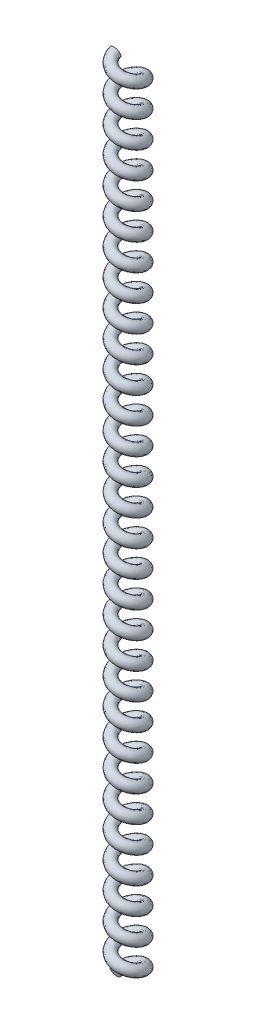
from build123d import *

# Parameters (mm, degrees)
SKETCH3_R = 1


with BuildPart() as part:
    # Sweep1: sweep along a curve in space
    with BuildLine() as sweep1_path:
        add(Edge.make_bspline(
            [(-2.5, 0, 0), (-2.5, 0.103560269, -0.325344182), (-2.369829679, 0.31278143, -0.982479294), (-1.813789111, 0.624924591, -1.813557683), (-0.981615594, 0.937520206, -2.36989169), (0, 1.249994586, -2.565068545), (0.981615594, 1.562501451, -2.369834131), (1.813789111, 1.874999611, -1.813787918), (2.369829679, 2.187500104, -0.981615913), (2.565085161, 2.499999972, 8.6e-08), (2.369829679, 2.812500007, 0.981615571), (1.813789111, 3.124999998, 1.813789117), (0.981615594, 3.437500001, 2.369829677), (0, 3.75, 2.565085161), (-0.981615594, 4.0625, 2.369829679), (-1.813789111, 4.375, 1.813789111), (-2.369829679, 4.6875, 0.981615594), (-2.565085161, 5, 0), (-2.369829679, 5.3125, -0.981615594), (-1.813789111, 5.625, -1.813789111), (-0.981615594, 5.9375, -2.369829679), (0, 6.25, -2.565085161), (0.981615594, 6.5625, -2.369829679), (1.813789111, 6.875, -1.813789111), (2.369829679, 7.1875, -0.981615594), (2.565085161, 7.5, 0), (2.369829679, 7.8125, 0.981615594), (1.813789111, 8.125, 1.813789111), (0.981615594, 8.4375, 2.369829679), (0, 8.75, 2.565085161), (-0.981615594, 9.0625, 2.369829679), (-1.813789111, 9.375, 1.813789111), (-2.369829679, 9.6875, 0.981615594), (-2.565085161, 10, 0), (-2.369829679, 10.3125, -0.981615594), (-1.813789111, 10.625, -1.813789111), (-0.981615594, 10.9375, -2.369829679), (0, 11.25, -2.565085161), (0.981615594, 11.5625, -2.369829679), (1.813789111, 11.875, -1.813789111), (2.369829679, 12.1875, -0.981615594), (2.565085161, 12.5, 0), (2.369829679, 12.8125, 0.981615594), (1.813789111, 13.125, 1.813789111), (0.981615594, 13.4375, 2.369829679), (0, 13.75, 2.565085161), (-0.981615594, 14.0625, 2.369829679), (-1.813789111, 14.375, 1.813789111), (-2.369829679, 14.6875, 0.981615594), (-2.565085161, 15, 0), (-2.369829679, 15.3125, -0.981615594), (-1.813789111, 15.625, -1.813789111), (-0.981615594, 15.9375, -2.369829679), (0, 16.25, -2.565085161), (0.981615594, 16.5625, -2.369829679), (1.813789111, 16.875, -1.813789111), (2.369829679, 17.1875, -0.981615594), (2.565085161, 17.5, 0), (2.369829679, 17.8125, 0.981615594), (1.813789111, 18.125, 1.813789111), (0.981615594, 18.4375, 2.369829679), (0, 18.75, 2.565085161), (-0.981615594, 19.0625, 2.369829679), (-1.813789111, 19.375, 1.813789111), (-2.369829679, 19.6875, 0.981615594), (-2.565085161, 20, 0), (-2.369829679, 20.3125, -0.981615594), (-1.813789111, 20.625, -1.813789111), (-0.981615594, 20.9375, -2.369829679), (0, 21.25, -2.565085161), (0.981615594, 21.5625, -2.369829679), (1.813789111, 21.875, -1.813789111), (2.369829679, 22.1875, -0.981615594), (2.565085161, 22.5, 0), (2.369829679, 22.8125, 0.981615594), (1.813789111, 23.125, 1.813789111), (0.981615594, 23.4375, 2.369829679), (0, 23.75, 2.565085161), (-0.981615594, 24.0625, 2.369829679), (-1.813789111, 24.375, 1.813789111), (-2.369829679, 24.6875, 0.981615594), (-2.565085161, 25, 0), (-2.369829679, 25.3125, -0.981615594), (-1.813789111, 25.625, -1.813789111), (-0.981615594, 25.9375, -2.369829679), (0, 26.25, -2.565085161), (0.981615594, 26.5625, -2.369829679), (1.813789111, 26.875, -1.813789111), (2.369829679, 27.1875, -0.981615594), (2.565085161, 27.5, 0), (2.369829679, 27.8125, 0.981615594), (1.813789111, 28.125, 1.813789111), (0.981615594, 28.4375, 2.369829679), (0, 28.75, 2.565085161), (-0.981615594, 29.0625, 2.369829679), (-1.813789111, 29.375, 1.813789111), (-2.369829679, 29.6875, 0.981615594), (-2.565085161, 30, 0), (-2.369829679, 30.3125, -0.981615594), (-1.813789111, 30.625, -1.813789111), (-0.981615594, 30.9375, -2.369829679), (0, 31.25, -2.565085161), (0.981615594, 31.5625, -2.369829679), (1.813789111, 31.875, -1.813789111), (2.369829679, 32.1875, -0.981615594), (2.565085161, 32.5, 0), (2.369829679, 32.8125, 0.981615594), (1.813789111, 33.125, 1.813789111), (0.981615594, 33.4375, 2.369829679), (0, 33.75, 2.565085161), (-0.981615594, 34.0625, 2.369829679), (-1.813789111, 34.375, 1.813789111), (-2.369829679, 34.6875, 0.981615594), (-2.565085161, 35, 0), (-2.369829679, 35.3125, -0.981615594), (-1.813789111, 35.625, -1.813789111), (-0.981615594, 35.9375, -2.369829679), (0, 36.25, -2.565085161), (0.981615594, 36.5625, -2.369829679), (1.813789111, 36.875, -1.813789111), (2.369829679, 37.1875, -0.981615594), (2.565085161, 37.5, 0), (2.369829679, 37.8125, 0.981615594), (1.813789111, 38.125, 1.813789111), (0.981615594, 38.4375, 2.369829679), (0, 38.75, 2.565085161), (-0.981615594, 39.0625, 2.369829679), (-1.813789111, 39.375, 1.813789111), (-2.369829679, 39.6875, 0.981615594), (-2.565085161, 40, 0), (-2.369829679, 40.3125, -0.981615594), (-1.813789111, 40.625, -1.813789111), (-0.981615594, 40.9375, -2.369829679), (0, 41.25, -2.565085161), (0.981615594, 41.5625, -2.369829679), (1.813789111, 41.875, -1.813789111), (2.369829679, 42.1875, -0.981615594), (2.565085161, 42.5, 0), (2.369829679, 42.8125, 0.981615594), (1.813789111, 43.125, 1.813789111), (0.981615594, 43.4375, 2.369829679), (0, 43.75, 2.565085161), (-0.981615594, 44.0625, 2.369829679), (-1.813789111, 44.375, 1.813789111), (-2.369829679, 44.6875, 0.981615594), (-2.565085161, 45, 0), (-2.369829679, 45.3125, -0.981615594), (-1.813789111, 45.625, -1.813789111), (-0.981615594, 45.9375, -2.369829679), (0, 46.25, -2.565085161), (0.981615594, 46.5625, -2.369829679), (1.813789111, 46.875, -1.813789111), (2.369829679, 47.1875, -0.981615594), (2.565085161, 47.5, 0), (2.369829679, 47.8125, 0.981615594), (1.813789111, 48.125, 1.813789111), (0.981615594, 48.4375, 2.369829679), (0, 48.75, 2.565085161), (-0.981615594, 49.0625, 2.369829679), (-1.813789111, 49.375, 1.813789111), (-2.369829679, 49.6875, 0.981615594), (-2.565085161, 50, 0), (-2.369829679, 50.3125, -0.981615594), (-1.813789111, 50.625, -1.813789111), (-0.981615594, 50.9375, -2.369829679), (0, 51.25, -2.565085161), (0.981615594, 51.5625, -2.369829679), (1.813789111, 51.875, -1.813789111), (2.369829679, 52.1875, -0.981615594), (2.565085161, 52.5, 0), (2.369829679, 52.8125, 0.981615594), (1.813789111, 53.125, 1.813789111), (0.981615594, 53.4375, 2.369829679), (0, 53.75, 2.565085161), (-0.981615594, 54.0625, 2.369829679), (-1.813789111, 54.375, 1.813789111), (-2.369829679, 54.6875, 0.981615594), (-2.565085161, 55, 0), (-2.369829679, 55.3125, -0.981615594), (-1.813789111, 55.625, -1.813789111), (-0.981615594, 55.9375, -2.369829679), (0, 56.25, -2.565085161), (0.981615594, 56.5625, -2.369829679), (1.813789111, 56.875, -1.813789111), (2.369829679, 57.1875, -0.981615594), (2.565085161, 57.5, 0), (2.369829679, 57.8125, 0.981615594), (1.813789111, 58.125, 1.813789111), (0.981615594, 58.4375, 2.369829679), (0, 58.75, 2.565085161), (-0.981615594, 59.0625, 2.369829679), (-1.813789111, 59.375, 1.813789111), (-2.369829679, 59.6875, 0.981615594), (-2.565085161, 60, 0), (-2.369829679, 60.3125, -0.981615594), (-1.813789111, 60.625, -1.813789111), (-0.981615594, 60.9375, -2.369829679), (0, 61.25, -2.565085161), (0.981615594, 61.5625, -2.369829679), (1.813789111, 61.875, -1.813789111), (2.369829679, 62.1875, -0.981615594), (2.565085161, 62.5, 0), (2.369829679, 62.8125, 0.981615594), (1.813789111, 63.125, 1.813789111), (0.981615594, 63.4375, 2.369829679), (0, 63.75, 2.565085161), (-0.981615594, 64.0625, 2.369829679), (-1.813789111, 64.375, 1.813789111), (-2.369829679, 64.6875, 0.981615594), (-2.565085161, 65, 0), (-2.369829679, 65.3125, -0.981615594), (-1.813789111, 65.625, -1.813789111), (-0.981615594, 65.9375, -2.369829679), (0, 66.25, -2.565085161), (0.981615594, 66.5625, -2.369829679), (1.813789111, 66.875, -1.813789111), (2.369829679, 67.1875, -0.981615594), (2.565085161, 67.5, 0), (2.369829679, 67.8125, 0.981615594), (1.813789111, 68.125, 1.813789111), (0.981615594, 68.4375, 2.369829679), (0, 68.75, 2.565085161), (-0.981615594, 69.0625, 2.369829679), (-1.813789111, 69.375, 1.813789111), (-2.369829679, 69.6875, 0.981615594), (-2.565085161, 70, 0), (-2.369829679, 70.3125, -0.981615594), (-1.813789111, 70.625, -1.813789111), (-0.981615594, 70.9375, -2.369829679), (0, 71.25, -2.565085161), (0.981615594, 71.5625, -2.369829679), (1.813789111, 71.875, -1.813789111), (2.369829679, 72.1875, -0.981615594), (2.565085161, 72.5, 0), (2.369829679, 72.8125, 0.981615594), (1.813789111, 73.125, 1.813789111), (0.981615594, 73.4375, 2.369829679), (0, 73.75, 2.565085161), (-0.981615594, 74.0625, 2.369829679), (-1.813789111, 74.375, 1.813789111), (-2.369829679, 74.6875, 0.981615594), (-2.565085161, 75, 0), (-2.369829679, 75.3125, -0.981615594), (-1.813789111, 75.625, -1.813789111), (-0.981615594, 75.9375, -2.369829679), (0, 76.25, -2.565085161), (0.981615594, 76.5625, -2.369829679), (1.813789111, 76.875, -1.813789111), (2.369829679, 77.1875, -0.981615594), (2.565085161, 77.5, 0), (2.369829679, 77.8125, 0.981615594), (1.813789111, 78.125, 1.813789111), (0.981615594, 78.4375, 2.369829679), (0, 78.75, 2.565085161), (-0.981615594, 79.0625, 2.369829679), (-1.813789111, 79.375, 1.813789111), (-2.369829679, 79.6875, 0.981615594), (-2.565085161, 80, 0), (-2.369829679, 80.3125, -0.981615594), (-1.813789111, 80.625, -1.813789111), (-0.981615594, 80.9375, -2.369829679), (0, 81.25, -2.565085161), (0.981615594, 81.5625, -2.369829679), (1.813789111, 81.875, -1.813789111), (2.369829679, 82.1875, -0.981615594), (2.565085161, 82.5, 0), (2.369829679, 82.8125, 0.981615594), (1.813789111, 83.125, 1.813789111), (0.981615594, 83.4375, 2.369829679), (0, 83.75, 2.565085161), (-0.981615594, 84.0625, 2.369829679), (-1.813789111, 84.375, 1.813789111), (-2.369829679, 84.6875, 0.981615594), (-2.565085161, 85, 0), (-2.369829679, 85.3125, -0.981615594), (-1.813789111, 85.625, -1.813789111), (-0.981615594, 85.9375, -2.369829679), (0, 86.25, -2.565085161), (0.981615594, 86.5625, -2.369829679), (1.813789111, 86.875, -1.813789111), (2.369829679, 87.1875, -0.981615594), (2.565085161, 87.5, 0), (2.369829679, 87.8125, 0.981615594), (1.813789111, 88.125, 1.813789111), (0.981615594, 88.4375, 2.369829679), (0, 88.75, 2.565085161), (-0.981615594, 89.0625, 2.369829679), (-1.813789111, 89.375, 1.813789111), (-2.369829679, 89.6875, 0.981615594), (-2.565085161, 90, 0), (-2.369829679, 90.3125, -0.981615594), (-1.813789111, 90.625, -1.813789111), (-0.981615594, 90.9375, -2.369829679), (0, 91.25, -2.565085161), (0.981615594, 91.5625, -2.369829679), (1.813789111, 91.875, -1.813789111), (2.369829679, 92.1875, -0.981615594), (2.565085161, 92.5, 0), (2.369829679, 92.8125, 0.981615594), (1.813789111, 93.125, 1.813789111), (0.981615594, 93.4375, 2.369829679), (0, 93.75, 2.565085161), (-0.981615594, 94.0625, 2.369829679), (-1.813789111, 94.375, 1.813789111), (-2.369829679, 94.6875, 0.981615594), (-2.565085161, 95, 0), (-2.369829679, 95.3125, -0.981615594), (-1.813789111, 95.625, -1.813789111), (-0.981615594, 95.9375, -2.369829679), (0, 96.25, -2.565085161), (0.981615594, 96.5625, -2.369829679), (1.813789111, 96.875, -1.813789111), (2.369829679, 97.1875, -0.981615594), (2.565085161, 97.5, 0), (2.369829679, 97.8125, 0.981615594), (1.813789111, 98.125, 1.813789111), (0.981615594, 98.4375, 2.369829679), (0, 98.75, 2.565085161), (-0.981615594, 99.0625, 2.369829679), (-1.813789111, 99.375, 1.813789111), (-2.369829679, 99.6875, 0.981615594), (-2.565085161, 100, 0), (-2.369829679, 100.3125, -0.981615594), (-1.813789111, 100.625, -1.813789111), (-0.981615594, 100.9375, -2.369829679), (0, 101.25, -2.565085161), (0.981615594, 101.5625, -2.369829679), (1.813789111, 101.875, -1.813789111), (2.369829679, 102.1875, -0.981615594), (2.565085161, 102.5, 0), (2.369829679, 102.8125, 0.981615594), (1.813789111, 103.125, 1.813789111), (0.981615594, 103.4375, 2.369829679), (0, 103.75, 2.565085161), (-0.981615594, 104.0625, 2.369829679), (-1.813789111, 104.375, 1.813789111), (-2.369829679, 104.6875, 0.981615594), (-2.565085161, 105, 0), (-2.369829679, 105.3125, -0.981615594), (-1.813789111, 105.625, -1.813789111), (-0.981615594, 105.9375, -2.369829679), (0, 106.25, -2.565085161), (0.981615594, 106.5625, -2.369829679), (1.813789111, 106.875, -1.813789111), (2.369829679, 107.1875, -0.981615594), (2.565085161, 107.5, 0), (2.369829679, 107.8125, 0.981615594), (1.813789111, 108.125, 1.813789111), (0.981615594, 108.4375, 2.369829679), (0, 108.75, 2.565085161), (-0.981615594, 109.0625, 2.369829679), (-1.813789111, 109.375, 1.813789111), (-2.369829679, 109.6875, 0.981615594), (-2.565085161, 110, 0), (-2.369829679, 110.3125, -0.981615594), (-1.813789111, 110.625, -1.813789111), (-0.981615594, 110.9375, -2.369829679), (0, 111.25, -2.565085161), (0.981615594, 111.5625, -2.369829679), (1.813789111, 111.875, -1.813789111), (2.369829679, 112.1875, -0.981615594), (2.565085161, 112.5, 0), (2.369829679, 112.8125, 0.981615594), (1.813789111, 113.125, 1.813789111), (0.981615594, 113.4375, 2.369829679), (0, 113.75, 2.565085161), (-0.981615594, 114.0625, 2.369829679), (-1.813789111, 114.375, 1.813789111), (-2.369829679, 114.6875, 0.981615594), (-2.565085161, 115, 0), (-2.369829679, 115.3125, -0.981615594), (-1.813789111, 115.625, -1.813789111), (-0.981615594, 115.9375, -2.369829679), (0, 116.25, -2.565085161), (0.981615594, 116.5625, -2.369829679), (1.813789111, 116.875, -1.813789111), (2.369829679, 117.1875, -0.981615594), (2.565085161, 117.5, 0), (2.369829679, 117.8125, 0.981615594), (1.813789111, 118.125, 1.813789111), (0.981615594, 118.4375, 2.369829679), (0, 118.75, 2.565085161), (-0.981615594, 119.0625, 2.369829679), (-1.813789111, 119.375, 1.813789111), (-2.369829679, 119.6875, 0.981615594), (-2.565085161, 120, 0), (-2.369829679, 120.3125, -0.981615594), (-1.813789111, 120.625, -1.813789111), (-0.981615594, 120.9375, -2.369829679), (0, 121.25, -2.565085161), (0.981615594, 121.5625, -2.369829679), (1.813789111, 121.875, -1.813789111), (2.369829679, 122.1875, -0.981615594), (2.565085161, 122.5, 0), (2.369829679, 122.8125, 0.981615594), (1.813789111, 123.125, 1.813789111), (0.981615594, 123.4375, 2.369829679), (0, 123.75, 2.565085161), (-0.981615594, 124.0625, 2.369829679), (-1.813789111, 124.375, 1.813789111), (-2.369829679, 124.6875, 0.981615594), (-2.565085161, 125, 0), (-2.369829679, 125.3125, -0.981615594), (-1.813789111, 125.625, -1.813789111), (-0.981615594, 125.9375, -2.369829679), (0, 126.25, -2.565085161), (0.981615594, 126.5625, -2.369829679), (1.813789111, 126.875, -1.813789111), (2.369829679, 127.1875, -0.981615594), (2.565085161, 127.5, 0), (2.369829679, 127.8125, 0.981615594), (1.813789111, 128.125, 1.813789111), (0.981615594, 128.4375, 2.369829679), (0, 128.75, 2.565085161), (-0.981615594, 129.0625, 2.369829679), (-1.813789111, 129.375, 1.813789111), (-2.369829679, 129.6875, 0.981615594), (-2.565085161, 130, 0), (-2.369829679, 130.3125, -0.981615594), (-1.813789111, 130.625, -1.813789111), (-0.981615594, 130.9375, -2.369829679), (0, 131.25, -2.565085161), (0.981615594, 131.5625, -2.369829679), (1.813789111, 131.875, -1.813789111), (2.369829679, 132.1875, -0.981615594), (2.565085161, 132.5, 0), (2.369829679, 132.8125, 0.981615594), (1.813789111, 133.125, 1.813789111), (0.981615594, 133.4375, 2.369829679), (0, 133.75, 2.565085161), (-0.981615594, 134.0625, 2.369829679), (-1.813789111, 134.375, 1.813789111), (-2.369829679, 134.6875, 0.981615594), (-2.565085161, 135, 0), (-2.369829679, 135.3125, -0.981615594), (-1.813789111, 135.625, -1.813789111), (-0.981615594, 135.9375, -2.369829679), (0, 136.25, -2.565085161), (0.981615594, 136.5625, -2.369829679), (1.813789111, 136.875, -1.813789111), (2.369829679, 137.1875, -0.981615594), (2.565085161, 137.5, 0), (2.369829679, 137.8125, 0.981615594), (1.813789111, 138.125, 1.813789111), (0.981615594, 138.4375, 2.369829679), (0, 138.75, 2.565085161), (-0.981615594, 139.0625, 2.369829679), (-1.813789111, 139.375, 1.813789111), (-2.369829679, 139.6875, 0.981615594), (-2.565085161, 140, 0), (-2.369829679, 140.3125, -0.981615594), (-1.813789111, 140.625, -1.813789111), (-0.981615594, 140.9375, -2.369829679), (0, 141.25, -2.565085161), (0.981615594, 141.5625, -2.369829679), (1.813789111, 141.875, -1.813789111), (2.369829679, 142.1875, -0.981615594), (2.565085161, 142.5, 0), (2.369829679, 142.8125, 0.981615594), (1.813789111, 143.125, 1.813789111), (0.981615594, 143.4375, 2.369829679), (0, 143.75, 2.565085161), (-0.981615594, 144.0625, 2.369829679), (-1.813789111, 144.375, 1.813789111), (-2.369829679, 144.6875, 0.981615594), (-2.565085161, 145, 0), (-2.369829679, 145.3125, -0.981615594), (-1.813789111, 145.625, -1.813789111), (-0.981615594, 145.9375, -2.369829679), (0, 146.25, -2.565085161), (0.981615594, 146.562499999, -2.369829677), (1.813789111, 146.875000002, -1.813789117), (2.369829679, 147.187499993, -0.981615571), (2.565085161, 147.500000028, -8.6e-08), (2.369829679, 147.812499896, 0.981615913), (1.813789111, 148.125000389, 1.813787918), (0.981615594, 148.437498549, 2.369834131), (0, 148.750005414, 2.565068545), (-0.981615594, 149.062479794, 2.36989169), (-1.813789111, 149.375075409, 1.813557683), (-2.369829679, 149.68721857, 0.982479294), (-2.5, 149.896439731, 0.325344182), (-2.5, 150, 0)],
            knots=[0, 0, 0, 0, 0.002083333, 0.004166667, 0.00625, 0.008333333, 0.010416667, 0.0125, 0.014583333, 0.016666667, 0.01875, 0.020833333, 0.022916667, 0.025, 0.027083333, 0.029166667, 0.03125, 0.033333333, 0.035416667, 0.0375, 0.039583333, 0.041666667, 0.04375, 0.045833333, 0.047916667, 0.05, 0.052083333, 0.054166667, 0.05625, 0.058333333, 0.060416667, 0.0625, 0.064583333, 0.066666667, 0.06875, 0.070833333, 0.072916667, 0.075, 0.077083333, 0.079166667, 0.08125, 0.083333333, 0.085416667, 0.0875, 0.089583333, 0.091666667, 0.09375, 0.095833333, 0.097916667, 0.1, 0.102083333, 0.104166667, 0.10625, 0.108333333, 0.110416667, 0.1125, 0.114583333, 0.116666667, 0.11875, 0.120833333, 0.122916667, 0.125, 0.127083333, 0.129166667, 0.13125, 0.133333333, 0.135416667, 0.1375, 0.139583333, 0.141666667, 0.14375, 0.145833333, 0.147916667, 0.15, 0.152083333, 0.154166667, 0.15625, 0.158333333, 0.160416667, 0.1625, 0.164583333, 0.166666667, 0.16875, 0.170833333, 0.172916667, 0.175, 0.177083333, 0.179166667, 0.18125, 0.183333333, 0.185416667, 0.1875, 0.189583333, 0.191666667, 0.19375, 0.195833333, 0.197916667, 0.2, 0.202083333, 0.204166667, 0.20625, 0.208333333, 0.210416667, 0.2125, 0.214583333, 0.216666667, 0.21875, 0.220833333, 0.222916667, 0.225, 0.227083333, 0.229166667, 0.23125, 0.233333333, 0.235416667, 0.2375, 0.239583333, 0.241666667, 0.24375, 0.245833333, 0.247916667, 0.25, 0.252083333, 0.254166667, 0.25625, 0.258333333, 0.260416667, 0.2625, 0.264583333, 0.266666667, 0.26875, 0.270833333, 0.272916667, 0.275, 0.277083333, 0.279166667, 0.28125, 0.283333333, 0.285416667, 0.2875, 0.289583333, 0.291666667, 0.29375, 0.295833333, 0.297916667, 0.3, 0.302083333, 0.304166667, 0.30625, 0.308333333, 0.310416667, 0.3125, 0.314583333, 0.316666667, 0.31875, 0.320833333, 0.322916667, 0.325, 0.327083333, 0.329166667, 0.33125, 0.333333333, 0.335416667, 0.3375, 0.339583333, 0.341666667, 0.34375, 0.345833333, 0.347916667, 0.35, 0.352083333, 0.354166667, 0.35625, 0.358333333, 0.360416667, 0.3625, 0.364583333, 0.366666667, 0.36875, 0.370833333, 0.372916667, 0.375, 0.377083333, 0.379166667, 0.38125, 0.383333333, 0.385416667, 0.3875, 0.389583333, 0.391666667, 0.39375, 0.395833333, 0.397916667, 0.4, 0.402083333, 0.404166667, 0.40625, 0.408333333, 0.410416667, 0.4125, 0.414583333, 0.416666667, 0.41875, 0.420833333, 0.422916667, 0.425, 0.427083333, 0.429166667, 0.43125, 0.433333333, 0.435416667, 0.4375, 0.439583333, 0.441666667, 0.44375, 0.445833333, 0.447916667, 0.45, 0.452083333, 0.454166667, 0.45625, 0.458333333, 0.460416667, 0.4625, 0.464583333, 0.466666667, 0.46875, 0.470833333, 0.472916667, 0.475, 0.477083333, 0.479166667, 0.48125, 0.483333333, 0.485416667, 0.4875, 0.489583333, 0.491666667, 0.49375, 0.495833333, 0.497916667, 0.5, 0.502083333, 0.504166667, 0.50625, 0.508333333, 0.510416667, 0.5125, 0.514583333, 0.516666667, 0.51875, 0.520833333, 0.522916667, 0.525, 0.527083333, 0.529166667, 0.53125, 0.533333333, 0.535416667, 0.5375, 0.539583333, 0.541666667, 0.54375, 0.545833333, 0.547916667, 0.55, 0.552083333, 0.554166667, 0.55625, 0.558333333, 0.560416667, 0.5625, 0.564583333, 0.566666667, 0.56875, 0.570833333, 0.572916667, 0.575, 0.577083333, 0.579166667, 0.58125, 0.583333333, 0.585416667, 0.5875, 0.589583333, 0.591666667, 0.59375, 0.595833333, 0.597916667, 0.6, 0.602083333, 0.604166667, 0.60625, 0.608333333, 0.610416667, 0.6125, 0.614583333, 0.616666667, 0.61875, 0.620833333, 0.622916667, 0.625, 0.627083333, 0.629166667, 0.63125, 0.633333333, 0.635416667, 0.6375, 0.639583333, 0.641666667, 0.64375, 0.645833333, 0.647916667, 0.65, 0.652083333, 0.654166667, 0.65625, 0.658333333, 0.660416667, 0.6625, 0.664583333, 0.666666667, 0.66875, 0.670833333, 0.672916667, 0.675, 0.677083333, 0.679166667, 0.68125, 0.683333333, 0.685416667, 0.6875, 0.689583333, 0.691666667, 0.69375, 0.695833333, 0.697916667, 0.7, 0.702083333, 0.704166667, 0.70625, 0.708333333, 0.710416667, 0.7125, 0.714583333, 0.716666667, 0.71875, 0.720833333, 0.722916667, 0.725, 0.727083333, 0.729166667, 0.73125, 0.733333333, 0.735416667, 0.7375, 0.739583333, 0.741666667, 0.74375, 0.745833333, 0.747916667, 0.75, 0.752083333, 0.754166667, 0.75625, 0.758333333, 0.760416667, 0.7625, 0.764583333, 0.766666667, 0.76875, 0.770833333, 0.772916667, 0.775, 0.777083333, 0.779166667, 0.78125, 0.783333333, 0.785416667, 0.7875, 0.789583333, 0.791666667, 0.79375, 0.795833333, 0.797916667, 0.8, 0.802083333, 0.804166667, 0.80625, 0.808333333, 0.810416667, 0.8125, 0.814583333, 0.816666667, 0.81875, 0.820833333, 0.822916667, 0.825, 0.827083333, 0.829166667, 0.83125, 0.833333333, 0.835416667, 0.8375, 0.839583333, 0.841666667, 0.84375, 0.845833333, 0.847916667, 0.85, 0.852083333, 0.854166667, 0.85625, 0.858333333, 0.860416667, 0.8625, 0.864583333, 0.866666667, 0.86875, 0.870833333, 0.872916667, 0.875, 0.877083333, 0.879166667, 0.88125, 0.883333333, 0.885416667, 0.8875, 0.889583333, 0.891666667, 0.89375, 0.895833333, 0.897916667, 0.9, 0.902083333, 0.904166667, 0.90625, 0.908333333, 0.910416667, 0.9125, 0.914583333, 0.916666667, 0.91875, 0.920833333, 0.922916667, 0.925, 0.927083333, 0.929166667, 0.93125, 0.933333333, 0.935416667, 0.9375, 0.939583333, 0.941666667, 0.94375, 0.945833333, 0.947916667, 0.95, 0.952083333, 0.954166667, 0.95625, 0.958333333, 0.960416667, 0.9625, 0.964583333, 0.966666667, 0.96875, 0.970833333, 0.972916667, 0.975, 0.977083333, 0.979166667, 0.98125, 0.983333333, 0.985416667, 0.9875, 0.989583333, 0.991666667, 0.99375, 0.995833333, 0.997916667, 1, 1, 1, 1], degree=3))
    # Sketch3 → Sweep1 (sweep)
    with BuildSketch(Plane(origin=(-2.5, 150, 0), x_dir=(-1, 0, 0), z_dir=(3.1500823294458685e-13, 0.3033144710533114, -0.9528905139887005))):
        with Locations((-0.164835954, 0.139869302)):
            Circle(SKETCH3_R)
    sweep(path=sweep1_path.line, is_frenet=True)


solid = part.part
